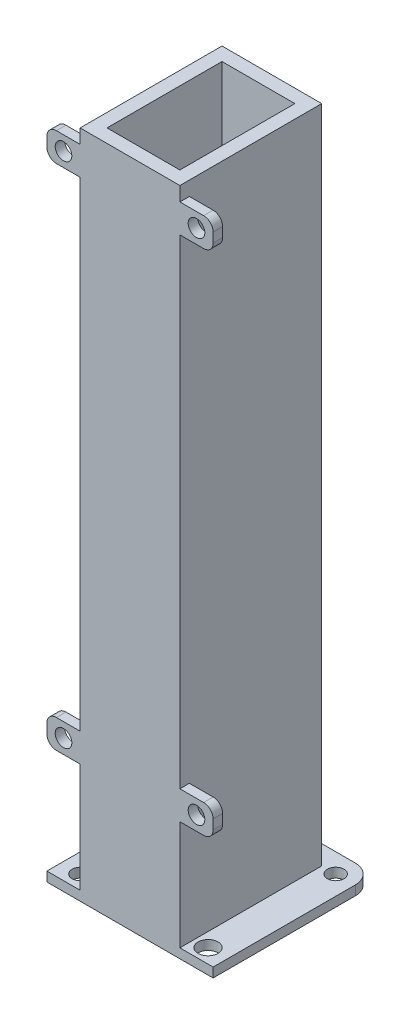
from build123d import *

# Parameters (mm, degrees)
ESQUISSE1_W                  = 35
ESQUISSE1_H                  = 35
BOSS_EXTRU_1_DEPTH           = 2
ESQUISSE2_R                  = 1.75
ESQUISSE2_W                  = 35
ESQUISSE2_H                  = 1.064971157
ENL_V_MAT_EXTRU_1_DEPTH      = 2
BOSS_EXTRU_2_DEPTH           = 280
ESQUISSE5_W                  = 7
ESQUISSE5_H                  = 6
ESQUISSE5_R                  = 1.75
BOSS_EXTRU_3_DEPTH           = 2
ESQUISSE6_R                  = 1.75
BOSS_EXTRU_4_DEPTH           = 2
ESQUISSE10_W                 = 35
ESQUISSE10_H                 = 33.935028843
ESQUISSE10_R                 = 1.75
BOSS_EXTRU_5_DEPTH           = 2
ESQUISSE15_R                 = 6.5
ESQUISSE15_R_2               = 1.75
ENL_V_MAT_EXTRU_2_DEPTH      = 373
CONG_1_R                     = 2
CONG_2_R                     = 4
ESQUISSE17_R                 = 1.75
BOSS_EXTRU_6_DEPTH           = 2
ENL_V_MAT_EXTRU_3_DEPTH      = 2
ENL_V_MAT_EXTRU_4_DEPTH      = 279
ENL_V_MAT_EXTRU_4_DEPTH_BACK = 391
ESQUISSE20_W                 = 15.34314575
ESQUISSE20_H                 = 24.213203648
ENL_V_MAT_EXTRU_5_DEPTH      = 20
ESQUISSE23_R                 = 2.1
ENL_V_MAT_EXTRU_6_DEPTH      = 10


with BuildPart() as part:
    # Esquisse1 → Boss.-Extru.1 (new body)
    with BuildSketch(Plane(origin=(0, 0, 0), x_dir=(1, 0, 0), z_dir=(0, 1, 0))):
        with Locations((17.5, -17.5)):
            Rectangle(ESQUISSE1_W, ESQUISSE1_H)
    extrude(amount=BOSS_EXTRU_1_DEPTH)

    # Esquisse2 → Enlèv. mat.-Extru.1 (cut)
    with BuildSketch(Plane(origin=(0, 2, 0), x_dir=(1, 0, 0), z_dir=(0, 1, 0))):
        with Locations(Location((30.935029054, -4.064971369, 0), (0, 0, 270))):
            Circle(ESQUISSE2_R)
        with Locations(Location((30.935028843, -30.935028843, 0), (0, 0, 270))):
            Circle(ESQUISSE2_R)
        with Locations(Location((4.064971369, -4.064970946, 0), (0, 0, 270))):
            Circle(ESQUISSE2_R)
        with Locations(Location((4.064971157, -30.935028843, 0), (0, 0, 270))):
            Circle(ESQUISSE2_R)
        with Locations((17.5, -34.467514421)):
            Rectangle(ESQUISSE2_W, ESQUISSE2_H)
    extrude(amount=-ENL_V_MAT_EXTRU_1_DEPTH, mode=Mode.SUBTRACT)

    # Esquisse4 → Boss.-Extru.2 (add)
    with BuildSketch(Plane(origin=(0, 2, 0), x_dir=(1, 0, 0), z_dir=(0, 1, 0))):
        Polygon((17.5, -33.935028843), (7, -33.935028843), (7, -4.064970946), (28, -4.064970946), (28, -33.935028843), align=None)
    extrude(amount=BOSS_EXTRU_2_DEPTH)

    # Esquisse5 → Boss.-Extru.3 (add)
    # profile 1 of 4: a face of its own
    with BuildSketch(Plane.XY.offset(33.935028843)):
        with Locations((31.5, 254)):
            Rectangle(ESQUISSE5_W, ESQUISSE5_H)
        with Locations((31.5, 254)):
            Circle(ESQUISSE5_R, mode=Mode.SUBTRACT)
    # profile 2 of 4: a face of its own
    with BuildSketch(Plane.XY.offset(33.935028843)):
        with Locations((3.5, 254)):
            Rectangle(ESQUISSE5_W, ESQUISSE5_H)
        with Locations((3.5, 254)):
            Circle(ESQUISSE5_R, mode=Mode.SUBTRACT)
    # profile 3 of 4: a face of its own
    with BuildSketch(Plane.XY.offset(33.935028843)):
        with Locations((31.5, 28)):
            Rectangle(ESQUISSE5_W, ESQUISSE5_H)
        with Locations((31.5, 28)):
            Circle(ESQUISSE5_R, mode=Mode.SUBTRACT)
    # profile 4 of 4: a face of its own
    with BuildSketch(Plane.XY.offset(33.935028843)):
        with Locations((3.5, 28)):
            Rectangle(ESQUISSE5_W, ESQUISSE5_H)
        with Locations((3.5, 28)):
            Circle(ESQUISSE5_R, mode=Mode.SUBTRACT)
    extrude(amount=-BOSS_EXTRU_3_DEPTH)

    # Esquisse6 → Boss.-Extru.4 (add)
    # profile 1 of 2: a face of its own
    with BuildSketch(Plane.XY.offset(33.935028843)):
        Polygon((7, 144), (0, 144), (0, 141), (0, 138), (7, 138), (7, 141), align=None)
        with Locations((3.5, 141)):
            Circle(ESQUISSE6_R, mode=Mode.SUBTRACT)
    # profile 2 of 2: a face of its own
    with BuildSketch(Plane.XY.offset(33.935028843)):
        Polygon((35, 144), (28, 144), (28, 141), (28, 138), (35, 138), (35, 141), align=None)
        with Locations((31.5, 141)):
            Circle(ESQUISSE6_R, mode=Mode.SUBTRACT)
    extrude(amount=-BOSS_EXTRU_4_DEPTH)

    # Esquisse10 → Boss.-Extru.5 (add)
    with BuildSketch(Plane(origin=(0, 282, 0), x_dir=(1, 0, 0), z_dir=(0, 1, 0))):
        with Locations((17.5, -16.967514422)):
            Rectangle(ESQUISSE10_W, ESQUISSE10_H)
        with Locations(Location((30.935028843, -30.935028843, 0), (0, 0, 270))):
            Circle(ESQUISSE10_R, mode=Mode.SUBTRACT)
        with Locations(Location((30.935028631, -4.064970946, 0), (0, 0, 270.000013863))):
            Circle(ESQUISSE10_R, mode=Mode.SUBTRACT)
        with Locations(Location((4.064970946, -4.064971369, 0), (0, 0, 270.000013863))):
            Circle(ESQUISSE10_R, mode=Mode.SUBTRACT)
        with Locations(Location((4.064971157, -30.935028843, 0), (0, 0, 270))):
            Circle(ESQUISSE10_R, mode=Mode.SUBTRACT)
    extrude(amount=-BOSS_EXTRU_5_DEPTH)

    # Esquisse15 → Enlèv. mat.-Extru.2 (cut)
    with BuildSketch(Plane(origin=(0, 282, 0), x_dir=(1, 0, 0), z_dir=(0, 1, 0))):
        with Locations(Location((17.5, -17.5, 0), (0, 0, 270))):
            Circle(ESQUISSE15_R)
        with Locations(Location((30.935029054, -4.064971369, 0), (0, 0, 270))):
            Circle(ESQUISSE15_R_2)
    extrude(amount=-ENL_V_MAT_EXTRU_2_DEPTH, mode=Mode.SUBTRACT)

    # Congé1
    cong_1_edges = [part.edges().sort_by_distance(p)[0] for p in [
        (0, 31, 32.935028843),
        (0, 25, 32.935028843),
        (0, 144, 32.935028843),
        (0, 138, 32.935028843),
        (35, 144, 32.935028843),
        (35, 138, 32.935028843),
        (35, 257, 32.935028843),
        (35, 251, 32.935028843),
        (0, 251, 32.935028843),
        (0, 257, 32.935028843),
        (35, 31, 32.935028843),
        (35, 25, 32.935028843),
    ]]
    fillet(cong_1_edges, radius=CONG_1_R)

    # Congé2
    cong_2_edges = [part.edges().sort_by_distance(p)[0] for p in [
        (35, 281, 0),
        (0, 281, 0),
        (0, 1, 0),
        (35, 1, 0),
    ]]
    fillet(cong_2_edges, radius=CONG_2_R)

    # Esquisse17 → Boss.-Extru.6 (add)
    # profile 1 of 4: a face of its own
    with BuildSketch(Plane.XY.offset(33.935028843)):
        with BuildLine():
            Line((0, 148), (0, 146))
            ThreePointArc((0, 146), (0.585786438, 144.585786438), (2, 144))
            Line((2, 144), (7, 144))
            Line((7, 144), (7, 150))
            Line((7, 150), (2, 150))
            ThreePointArc((2, 150), (0.585786438, 149.414213562), (0, 148))
        make_face()
        with Locations((3.5, 147)):
            Circle(ESQUISSE17_R, mode=Mode.SUBTRACT)
    # profile 2 of 4: a face of its own
    with BuildSketch(Plane.XY.offset(33.935028843)):
        with BuildLine():
            Line((0, 136), (0, 134))
            ThreePointArc((0, 134), (0.585786438, 132.585786438), (2, 132))
            Line((2, 132), (7, 132))
            Line((7, 132), (7, 138))
            Line((7, 138), (2, 138))
            ThreePointArc((2, 138), (0.585786438, 137.414213562), (0, 136))
        make_face()
        with Locations((3.5, 135)):
            Circle(ESQUISSE17_R, mode=Mode.SUBTRACT)
    # profile 3 of 4: a face of its own
    with BuildSketch(Plane.XY.offset(33.935028843)):
        with BuildLine():
            ThreePointArc((35, 134), (34.414213562, 132.585786438), (33, 132))
            Line((33, 132), (28, 132))
            Line((28, 132), (28, 138))
            Line((28, 138), (33, 138))
            ThreePointArc((33, 138), (34.414213562, 137.414213562), (35, 136))
            Line((35, 136), (35, 134))
        make_face()
        with Locations((31.5, 135)):
            Circle(ESQUISSE17_R, mode=Mode.SUBTRACT)
    # profile 4 of 4: a face of its own
    with BuildSketch(Plane.XY.offset(33.935028843)):
        with BuildLine():
            ThreePointArc((35, 146), (34.414213562, 144.585786438), (33, 144))
            Line((33, 144), (28, 144))
            Line((28, 144), (28, 150))
            Line((28, 150), (33, 150))
            ThreePointArc((33, 150), (34.414213562, 149.414213562), (35, 148))
            Line((35, 148), (35, 146))
        make_face()
        with Locations((31.5, 147)):
            Circle(ESQUISSE17_R, mode=Mode.SUBTRACT)
    extrude(amount=-BOSS_EXTRU_6_DEPTH)

    # Esquisse18 → Enlèv. mat.-Extru.3 (cut)
    with BuildSketch(Plane.XY.offset(33.935028843)):
        Polygon((2, 138), (7, 138), (7, 144), (2, 144), (-2.362534847, 144), (-2.362534847, 138), align=None)
        Polygon((37.362534847, 138), (33, 138), (28, 138), (28, 144), (33, 144), (37.362534847, 144), align=None)
    extrude(amount=-ENL_V_MAT_EXTRU_3_DEPTH, mode=Mode.SUBTRACT)

    # Esquisse19 → Enlèv. mat.-Extru.4 (cut, two sides: drawn at the far end of the back side and taken through both)
    with BuildSketch(Plane(origin=(0, 0, 4.064970946), x_dir=(-1, 0, 0), z_dir=(0, 0, -1)).offset(-ENL_V_MAT_EXTRU_4_DEPTH_BACK)):
        Polygon((-28, 141), (-7, 141), (34.536866168, 141), (34.536866168, 293.648195663), (-77.45188643, 293.648195663), (-77.45188643, 143.905659046), align=None)
    extrude(amount=ENL_V_MAT_EXTRU_4_DEPTH + ENL_V_MAT_EXTRU_4_DEPTH_BACK, mode=Mode.SUBTRACT)

    # Esquisse20 → Enlèv. mat.-Extru.5 (cut)
    with BuildSketch(Plane(origin=(0, 141, 0), x_dir=(1, 0, 0), z_dir=(0, 1, 0))):
        with Locations((17.5, -18.999999894)):
            Rectangle(ESQUISSE20_W, ESQUISSE20_H)
    extrude(amount=-ENL_V_MAT_EXTRU_5_DEPTH, mode=Mode.SUBTRACT)

    # Esquisse23 → Enlèv. mat.-Extru.6 (cut)
    with BuildSketch(Plane(origin=(0, 2, 0), x_dir=(1, 0, 0), z_dir=(0, 1, 0))):
        with Locations(Location((30.935028843, -30.935028843, 0), (0, 0, 270))):
            Circle(ESQUISSE23_R)
    extrude(amount=-ENL_V_MAT_EXTRU_6_DEPTH, mode=Mode.SUBTRACT)


solid = part.part
